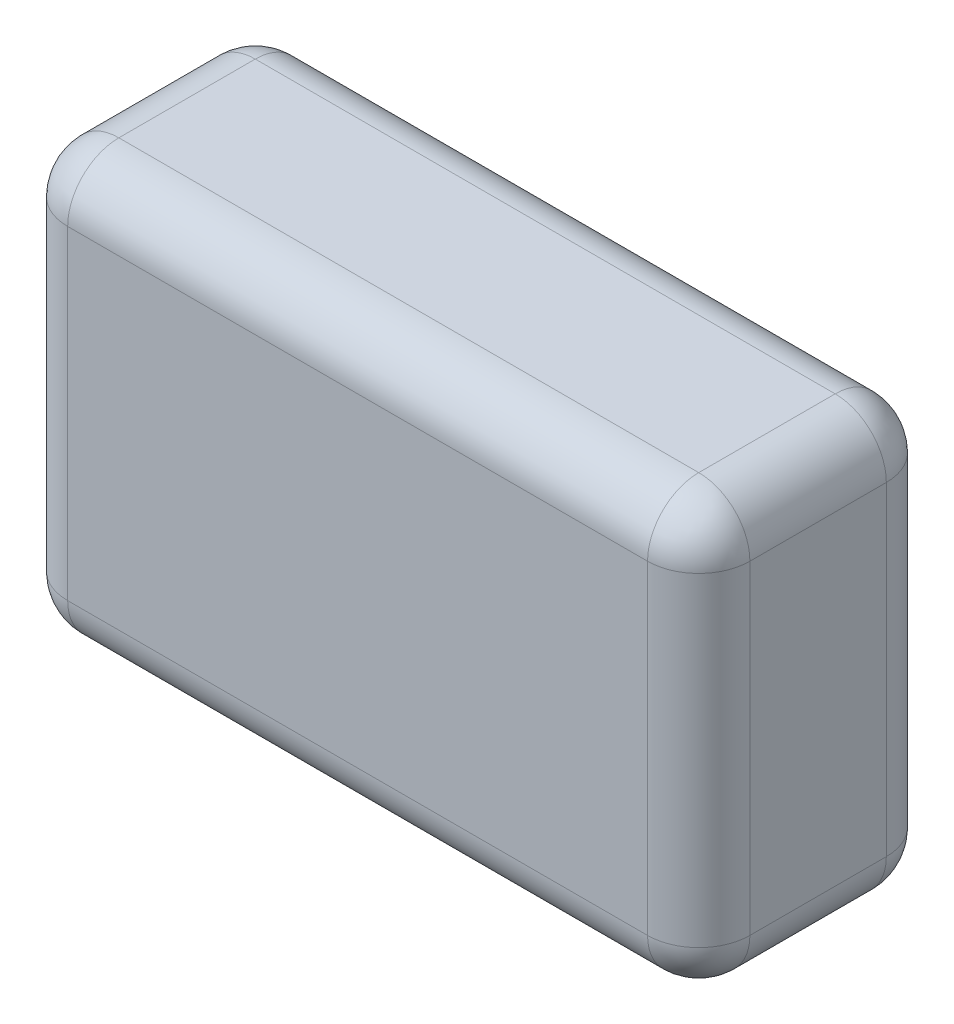
from build123d import *

# Parameters (mm, degrees)
SKETCH1_W           = 40
SKETCH1_H           = 14
BOSS_EXTRUDE1_DEPTH = 25
FILLET1_R           = 3


with BuildPart() as part:
    # Sketch1 → Boss-Extrude1 (new body)
    with BuildSketch(Plane(origin=(0, 0, 0), x_dir=(1, 0, 0), z_dir=(0, 1, 0))):
        Rectangle(SKETCH1_W, SKETCH1_H)
    extrude(amount=BOSS_EXTRUDE1_DEPTH)

    # Fillet1
    fillet1_edges = [part.edges().sort_by_distance(p)[0] for p in [
        (-20, 25, 0),
        (0, 25, 7),
        (20, 25, 0),
        (0, 0, 7),
        (-20, 0, 0),
        (0, 0, -7),
        (20, 0, 0),
        (20, 12.5, 7),
        (-20, 12.5, 7),
        (-20, 12.5, -7),
        (20, 12.5, -7),
        (0, 25, -7),
    ]]
    fillet(fillet1_edges, radius=FILLET1_R)


solid = part.part
